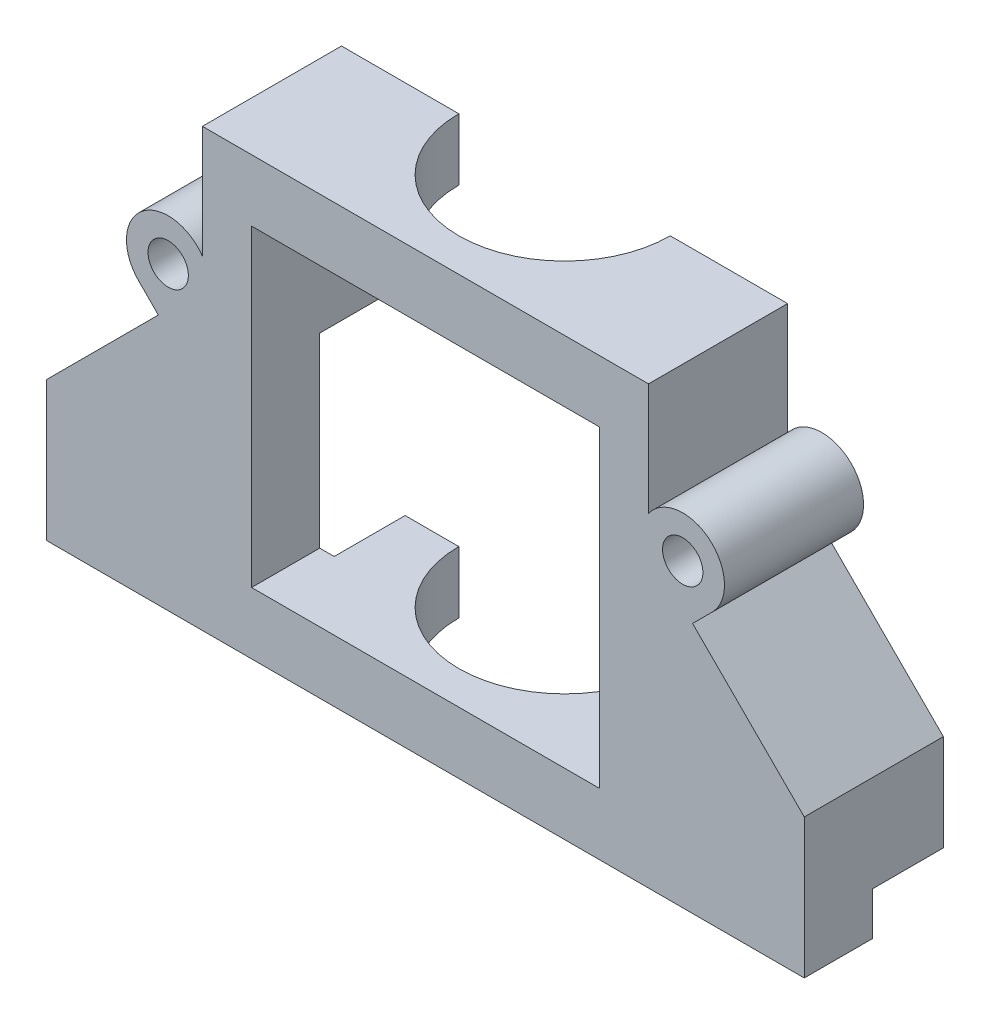
from build123d import *

# Parameters (mm, degrees)
SKETCH2_R           = 19.05
BOSS_EXTRUDE1_DEPTH = 152.4
BOSS_EXTRUDE2_DEPTH = 12.7
SKETCH4_W           = 138.346275672
SKETCH4_H           = 79.731841005
BOSS_EXTRUDE3_DEPTH = 50.8
SKETCH5_W           = 63.5
SKETCH5_H           = 57.15
CUT_EXTRUDE1_DEPTH  = 132.116075905
CUT_EXTRUDE2_DEPTH  = 132.116075905
CUT_EXTRUDE3_DEPTH  = 124.514960069
SKETCH9_R           = 3.683
BOSS_EXTRUDE4_DEPTH = 25.4
CLEARANCECUT1_DEPTH = 109.569099969
CLEARANCECUT2_DEPTH = 12.954


with BuildPart() as part:
    # Sketch2 → Boss-Extrude1 (new body)
    with BuildSketch(Plane(origin=(0, 0, 0), x_dir=(1, 0, 0), z_dir=(0, 1, 0))):
        with Locations(Location((0, 0, 0), (0, 0, 90))):
            Circle(SKETCH2_R)
    extrude(amount=BOSS_EXTRUDE1_DEPTH)

    # Sketch3 → Boss-Extrude2 (add, symmetric)
    with BuildSketch(Plane.XY):
        Polygon((-427.750314484, -331.6732), (-409.789802242, -313.712687758), (-391.82929, -331.6732), align=None)
        Polygon((-6.028675512, 90.048438972), (-409.789802242, -313.712687758), (-391.82929, -331.6732), (11.93183673, 72.08792673), align=None)
    boss_extrude2 = extrude(amount=BOSS_EXTRUDE2_DEPTH, both=True)

    # Mirror1: Boss-Extrude2 across plane
    add(boss_extrude2.mirror(Plane(origin=(0, 0, 0), x_dir=(0, 0, 1), z_dir=(1, 0, 0))))


with BuildPart() as body_2:
    # Sketch4 → Boss-Extrude3 (new body)
    with BuildSketch(Plane.XY.offset(25.4)):
        with Locations((0, 59.259567455)):
            Rectangle(SKETCH4_W, SKETCH4_H)
    extrude(amount=-BOSS_EXTRUDE3_DEPTH)

    # Combine1: cut part
    add(part.part, mode=Mode.SUBTRACT)

    # Sketch5 → Cut-Extrude1 (cut, through all)
    with BuildSketch(Plane.XY.offset(25.4)):
        with Locations((0, 59.259567454)):
            Rectangle(SKETCH5_W, SKETCH5_H)
    extrude(amount=-CUT_EXTRUDE1_DEPTH, mode=Mode.SUBTRACT)

    # Sketch6 → Cut-Extrude2 (cut, through all)
    with BuildSketch(Plane.XY.offset(25.4)):
        Polygon((-69.173137836, 99.125487957), (-69.173137836, 44.864488891), (-40.730256121, 73.307370605), (-40.730256121, 99.125487957), align=None)
    cut_extrude2 = extrude(amount=-CUT_EXTRUDE2_DEPTH, mode=Mode.SUBTRACT)

    # Mirror2: Cut-Extrude2 across plane
    add(cut_extrude2.mirror(Plane(origin=(0, 0, 0), x_dir=(0, 0, 1), z_dir=(1, 0, 0))), mode=Mode.SUBTRACT)

    # Sketch8 → Cut-Extrude3 (cut, through all)
    with BuildSketch(Plane.XY):
        Polygon((69.173137836, 19.393646952), (69.173137836, 44.864488891), (40.730256121, 73.307370605), (40.730256121, 99.125487957), (-40.730256121, 99.125487957), (-40.730256121, 73.307370605), (-69.173137836, 44.864488891), (-69.173137836, 19.393646952), align=None)
    extrude(amount=-CUT_EXTRUDE3_DEPTH, mode=Mode.SUBTRACT)

    # Sketch9 → Boss-Extrude4 (add)
    with BuildSketch(Plane(origin=(0, 0, 0), x_dir=(-1, 0, 0), z_dir=(0, 0, -1))):
        with BuildLine():
            Line((-48.773997692, 65.263629035), (-39.369751391, 74.667875336))
            ThreePointArc((-39.369751391, 74.667875336), (-50.088798441, 81.199961636), (-52.36610014, 68.855731483))
            Line((-52.36610014, 68.855731483), (-48.773997692, 65.263629035))
        make_face()
        with Locations((-46.977946468, 74.243885156)):
            Circle(SKETCH9_R, mode=Mode.SUBTRACT)
    boss_extrude4 = extrude(amount=-BOSS_EXTRUDE4_DEPTH)

    # Mirror3: Boss-Extrude4 across plane
    add(boss_extrude4.mirror(Plane(origin=(0, 0, 0), x_dir=(0, 0, 1), z_dir=(1, 0, 0))))

    # Sketch10 → ClearanceCut1 (cut, through all)
    with BuildSketch(Plane.XZ.offset(-19.393646952)):
        with BuildLine():
            Line((-19.05, 0), (-19.304, 0))
            ThreePointArc((-19.304, 0), (0, 19.304), (19.304, 0))
            Line((19.304, 0), (19.05, 0))
            ThreePointArc((19.05, 0), (0, 19.05), (-19.05, 0))
        make_face()
    extrude(amount=-CLEARANCECUT1_DEPTH, mode=Mode.SUBTRACT)

    # Sketch11 → ClearanceCut2 (cut)
    with BuildSketch(Plane(origin=(0, 0, 0), x_dir=(-1, 0, 0), z_dir=(0, 0, -1))):
        Polygon((-69.173137836, 27.263186893), (-29.112312301, 67.324012428), (-29.112312301, 30.684567454), (-40.403232803, 19.393646952), (-69.173137836, 19.393646952), align=None)
    clearancecut2 = extrude(amount=-CLEARANCECUT2_DEPTH, mode=Mode.SUBTRACT)

    # Mirror4: ClearanceCut2 across plane
    add(clearancecut2.mirror(Plane(origin=(0, 0, 0), x_dir=(0, 0, 1), z_dir=(1, 0, 0))), mode=Mode.SUBTRACT)


solid = body_2.part
